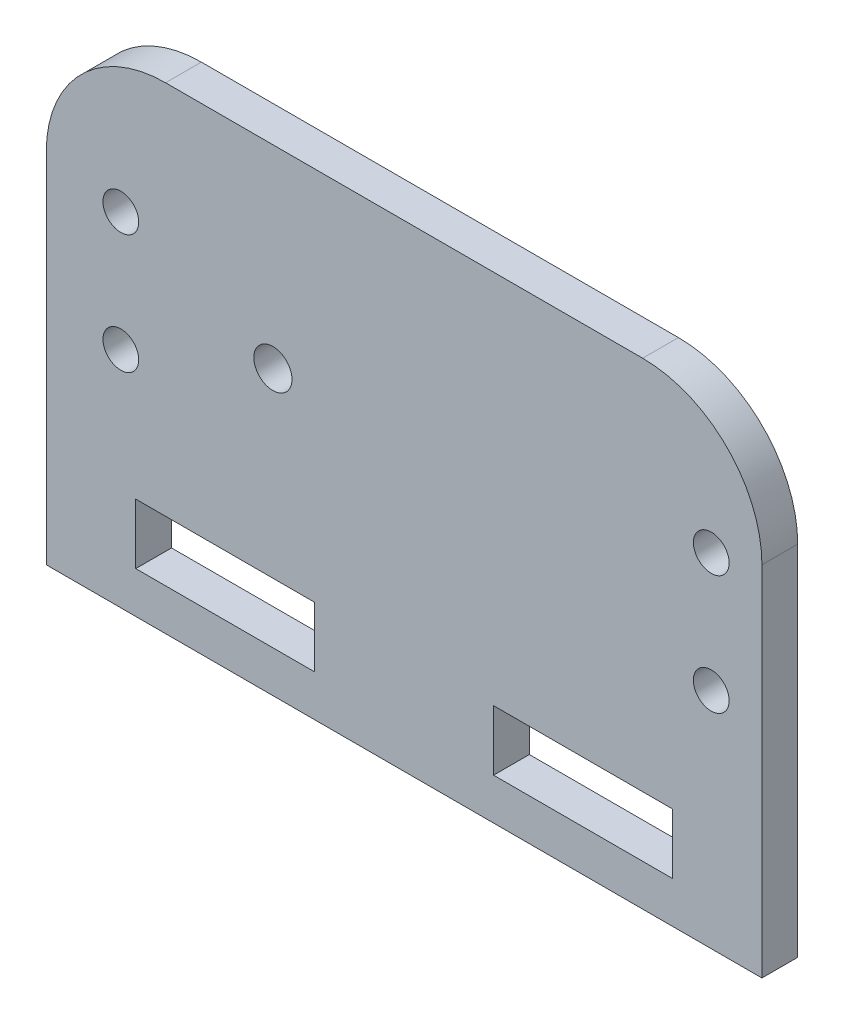
from build123d import *

# Parameters (mm, degrees)
ESQUISSE1_W             = 15
ESQUISSE1_H             = 5.05
BOSS_EXTRU_1_DEPTH      = 3
ESQUISSE2_R             = 7.5
ESQUISSE2_R_2           = 1.6
ENL_V_MAT_EXTRU_1_DEPTH = 37.18010503
ESQUISSE3_R             = 1.5
ENL_V_MAT_EXTRU_2_DEPTH = 37.18010503


with BuildPart() as part:
    # Esquisse1 → Boss.-Extru.1 (new body)
    with BuildSketch(Plane.XY):
        with BuildLine():
            Line((-20, 20), (20, 20))
            ThreePointArc((20, 20), (27.071067812, 17.071067812), (30, 10))
            Line((30, 10), (30, -20))
            Line((30, -20), (-30, -20))
            Line((-30, -20), (-30, 10))
            ThreePointArc((-30, 10), (-27.071067812, 17.071067812), (-20, 20))
        make_face()
        with Locations((15, -14)):
            Rectangle(ESQUISSE1_W, ESQUISSE1_H, mode=Mode.SUBTRACT)
        with Locations((-15, -14)):
            Rectangle(ESQUISSE1_W, ESQUISSE1_H, mode=Mode.SUBTRACT)
    extrude(amount=BOSS_EXTRU_1_DEPTH)

    # Esquisse2 → Enlèv. mat.-Extru.1 (cut, through all)
    with BuildSketch(Plane.XY.offset(3)):
        with Locations((11, -35.28215794)):
            Circle(ESQUISSE2_R)
        with Locations((-11, 3.753166138)):
            Circle(ESQUISSE2_R_2)
    extrude(amount=-ENL_V_MAT_EXTRU_1_DEPTH, mode=Mode.SUBTRACT)

    # Esquisse3 → Enlèv. mat.-Extru.2 (cut, through all)
    with BuildSketch(Plane(origin=(0, 0, 0), x_dir=(-1, 0, 0), z_dir=(0, 0, -1))):
        with Locations((-25.75, 8.753166138)):
            Circle(ESQUISSE3_R)
        with Locations((-25.75, -1.246833862)):
            Circle(ESQUISSE3_R)
        with Locations((23.75, 8.753166138)):
            Circle(ESQUISSE3_R)
        with Locations((23.75, -1.246833862)):
            Circle(ESQUISSE3_R)
    extrude(amount=-ENL_V_MAT_EXTRU_2_DEPTH, mode=Mode.SUBTRACT)


solid = part.part
